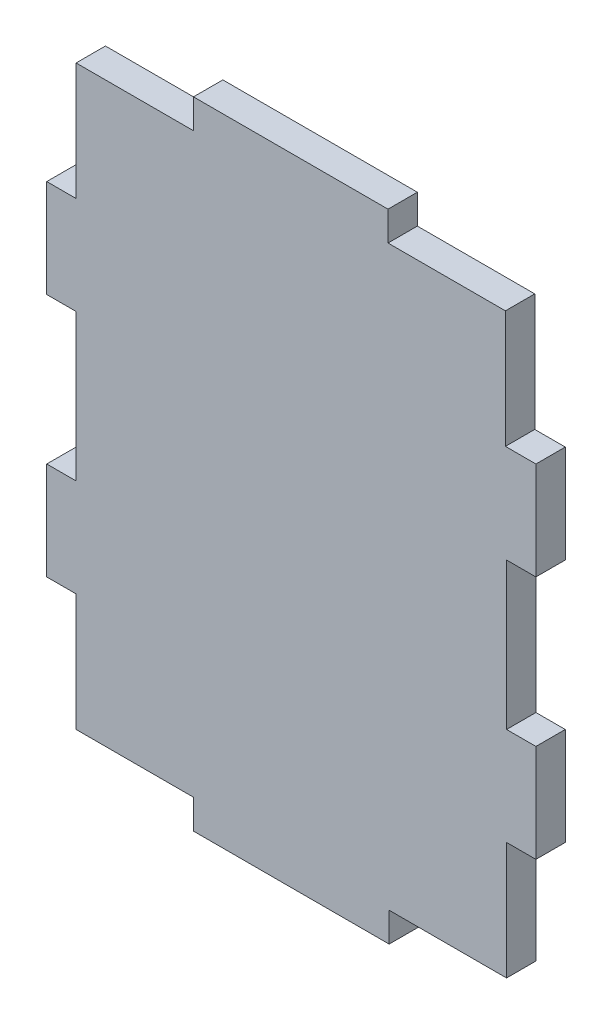
from build123d import *

# Parameters (mm, degrees)
ESQUISSE1_W             = 100
ESQUISSE1_H             = 130
BOSS_EXTRU_1_DEPTH      = 6
ESQUISSE2_W             = 6
ESQUISSE2_H             = 30
ENL_V_MAT_EXTRU_1_DEPTH = 6


with BuildPart() as part:
    # Esquisse1 → Boss.-Extru.1 (new body)
    with BuildSketch(Plane.XY):
        with Locations((-50, 65)):
            Rectangle(ESQUISSE1_W, ESQUISSE1_H)
    extrude(amount=BOSS_EXTRU_1_DEPTH)

    # Esquisse2 → Enlèv. mat.-Extru.1 (cut)
    with BuildSketch(Plane.XY.offset(6)):
        Polygon((-100, 130), (-70, 130), (-70, 124), (-94, 124), (-94, 100), (-100, 100), align=None)
        Polygon((0, 130), (-30.235491659, 130), (-30.235491659, 124), (-6.235491659, 124), (-6.235491659, 100), (0, 100), align=None)
        Polygon((-100, 0), (-70, 0), (-70, 6), (-94, 6), (-94, 30), (-100, 30), align=None)
        Polygon((0, 0), (-30, 0), (-30, 6), (-6, 6), (-6, 30), (0, 30), align=None)
        with Locations((-97, 65)):
            Rectangle(ESQUISSE2_W, ESQUISSE2_H)
        with Locations((-3, 65)):
            Rectangle(ESQUISSE2_W, ESQUISSE2_H)
    extrude(amount=-ENL_V_MAT_EXTRU_1_DEPTH, mode=Mode.SUBTRACT)


solid = part.part
